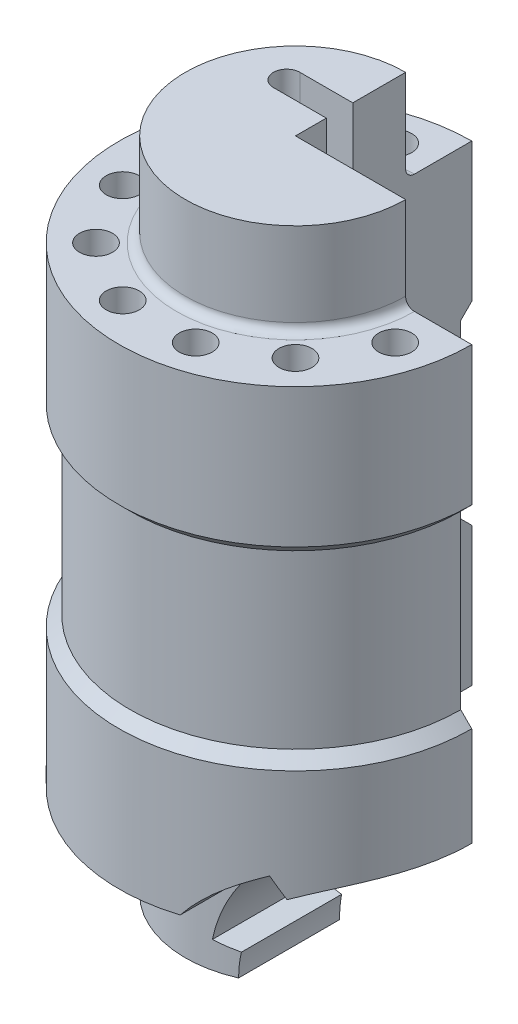
from build123d import *

# Parameters (mm, degrees)
SKETCH1_R               = 40
BOSS_EXTRUDE1_DEPTH     = 74.5
SKETCH3_R               = 40
SKETCH3_R_2             = 25
CUT_EXTRUDE1_DEPTH      = 21
CUT_EXTRUDE2_DEPTH      = 22
CUT_EXTRUDE2_DEPTH_BACK = 22
SKETCH2_R               = 40
SKETCH2_R_2             = 37.5
CUT_EXTRUDE4_DEPTH      = 160.376911753
FILLET1_R               = 2
CUT_EXTRUDE5_DEPTH      = 160.376911753
SKETCH8_R               = 3.75
CUT_EXTRUDE6_DEPTH      = 140.942845476
CUT_EXTRUDE7_DEPTH      = 94.542770966


with BuildPart() as part:
    # Sketch1 → Boss-Extrude1 (new, symmetric)
    with BuildSketch(Plane(origin=(0, 0, 0), x_dir=(1, 0, 0), z_dir=(0, 1, 0))):
        with Locations(Location((0, 0, 0), (0, 0, 270))):
            Circle(SKETCH1_R)
    extrude(amount=BOSS_EXTRUDE1_DEPTH, both=True)

    # Sketch3 → Cut-Extrude1 (cut)
    with BuildSketch(Plane(origin=(0, 74.5, 0), x_dir=(1, 0, 0), z_dir=(0, 1, 0))):
        with Locations(Location((0, 0, 0), (0, 0, 270))):
            Circle(SKETCH3_R)
        with Locations(Location((0, 0, 0), (0, 0, 270))):
            Circle(SKETCH3_R_2, mode=Mode.SUBTRACT)
    cut_extrude1 = extrude(amount=-CUT_EXTRUDE1_DEPTH, mode=Mode.SUBTRACT)

    # Mirror1: Cut-Extrude1 across plane
    add(cut_extrude1.mirror(Plane.ZX), mode=Mode.SUBTRACT)

    # Sketch2 → Cut-Extrude2 (cut, two sides: drawn at the far end of the back side and taken through both)
    with BuildSketch(Plane(origin=(0, 0, 0), x_dir=(1, 0, 0), z_dir=(0, 1, 0)).offset(-CUT_EXTRUDE2_DEPTH_BACK)):
        with Locations(Location((0, 0, 0), (0, 0, 270))):
            Circle(SKETCH2_R)
        with Locations(Location((0, 0, 0), (0, 0, 90))):
            Circle(SKETCH2_R_2, mode=Mode.SUBTRACT)
    extrude(amount=CUT_EXTRUDE2_DEPTH + CUT_EXTRUDE2_DEPTH_BACK, mode=Mode.SUBTRACT)

    # Sketch5 → Cut-Extrude4 (cut, through all)
    with BuildSketch(Plane(origin=(0, 74.5, 0), x_dir=(1, 0, 0), z_dir=(0, 1, 0))):
        with BuildLine():
            Line((-12, 13), (12, 13))
            ThreePointArc((12, 13), (15, 10), (12, 7))
            Line((12, 7), (-12, 7))
            ThreePointArc((-12, 7), (-15, 10), (-12, 13))
        make_face()
    extrude(amount=-CUT_EXTRUDE4_DEPTH, mode=Mode.SUBTRACT)

    # Fillet1
    fillet1_edges = [part.edges().sort_by_distance(p)[0] for p in [
        (0, -53.5, -25),
        (0, 53.5, -25),
    ]]
    fillet(fillet1_edges, radius=FILLET1_R)

    # Sketch7 → Revolve2 (revolve)
    with BuildSketch(Plane(origin=(0, 0, 0), x_dir=(0, 0, -1), z_dir=(1, 0, 0))):
        Polygon((40, 22), (37.5, 19.5), (37.5, 22), align=None)
    revolve2 = revolve(axis=Axis((0, 103.881416882, 0), (0, -1, 0)))

    # Mirror2: Revolve2 across plane
    add(revolve2.mirror(Plane.ZX))

    # Sketch4 → Cut-Extrude5 (cut, through all)
    with BuildSketch(Plane(origin=(0, 74.5, 0), x_dir=(1, 0, 0), z_dir=(0, 1, 0))):
        with BuildLine():
            Line((0, 0), (0, 40))
            ThreePointArc((0, 40), (28.284271247, 28.284271247), (40, 0))
            Line((40, 0), (0, 0))
        make_face()
    extrude(amount=-CUT_EXTRUDE5_DEPTH, mode=Mode.SUBTRACT)

    # Sketch8 → Cut-Extrude6 (cut, through all)
    with BuildSketch(Plane(origin=(0, 53.5, 0), x_dir=(1, 0, 0), z_dir=(0, 1, 0))):
        with Locations(Location((-8.282209443, 30.909626441, 0), (0, 0, 270))):
            Circle(SKETCH8_R)
        with Locations(Location((30.909626441, -8.282209443, 0), (0, 0, 270))):
            Circle(SKETCH8_R)
        with Locations(Location((22.627416998, -22.627416998, 0), (0, 0, 270))):
            Circle(SKETCH8_R)
        with Locations(Location((8.282209443, -30.909626441, 0), (0, 0, 270))):
            Circle(SKETCH8_R)
        with Locations(Location((-8.282209443, -30.909626441, 0), (0, 0, 270))):
            Circle(SKETCH8_R)
        with Locations(Location((-22.627416998, -22.627416998, 0), (0, 0, 270))):
            Circle(SKETCH8_R)
        with Locations(Location((-30.909626441, -8.282209443, 0), (0, 0, 270))):
            Circle(SKETCH8_R)
        with Locations(Location((-30.909626441, 8.282209443, 0), (0, 0, 270))):
            Circle(SKETCH8_R)
        with Locations(Location((-22.627416998, 22.627416998, 0), (0, 0, 270))):
            Circle(SKETCH8_R)
    extrude(amount=-CUT_EXTRUDE6_DEPTH, mode=Mode.SUBTRACT)

    # Sketch10 → Cut-Extrude7 (cut, through all)
    with BuildSketch(Plane(origin=(0, 0, 0), x_dir=(-1, 0, 0), z_dir=(0, 0, -1))):
        with BuildLine():
            Line((-25.208360839, -42.779227454), (-27.321452148, -47.310766389))
            ThreePointArc((-27.321452148, -47.310766389), (-33.506811582, -45.211119786), (-40, -44.5))
            Line((-40, -44.5), (-40, -53.5))
            Line((-40, -53.5), (-27, -53.5))
            ThreePointArc((-27, -53.5), (-25.585786438, -54.085786438), (-25, -55.5))
            Line((-25, -55.5), (-25, -74.5))
            Line((-25, -74.5), (-10, -74.5))
            ThreePointArc((-10, -74.5), (-10.114159057, -71.885327718), (-10.45576741, -69.29055467))
            Line((-10.45576741, -69.29055467), (-5.531728645, -68.422313782))
            ThreePointArc((-5.531728645, -68.422313782), (-12.23263309, -53.193349985), (-25.208360839, -42.779227454))
        make_face()
    extrude(amount=-CUT_EXTRUDE7_DEPTH, mode=Mode.SUBTRACT)


solid = part.part
